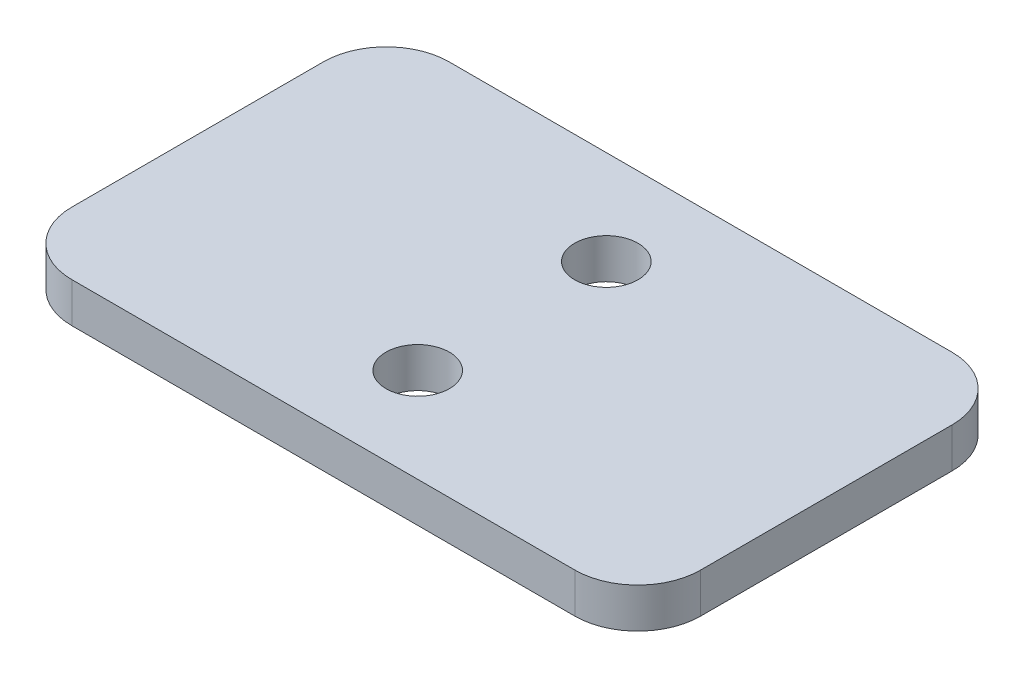
from build123d import *

# Parameters (mm, degrees)
SKETCH1_W               = 100
SKETCH1_H               = 60
BOSS_EXTRUDE1_DEPTH     = 6.35
F_3_8_CLEARANCE_HOLE1_D = 10.0838
FILLET1_R               = 10


with BuildPart() as part:
    # Sketch1 → Boss-Extrude1 (new body)
    with BuildSketch(Plane(origin=(0, 0, 0), x_dir=(1, 0, 0), z_dir=(0, 1, 0))):
        Rectangle(SKETCH1_W, SKETCH1_H)
    extrude(amount=BOSS_EXTRUDE1_DEPTH)

    # 3/8 Clearance Hole1 (through all)
    with Locations(Plane(origin=(0, 6.35, 0), x_dir=(1, 0, 0), z_dir=(0, 1, 0))):
        with Locations((0, 15), (0, -15)):
            Hole(F_3_8_CLEARANCE_HOLE1_D / 2)

    # Fillet1
    fillet1_edges = [part.edges().sort_by_distance(p)[0] for p in [
        (-50, 3.175, 30),
        (-50, 3.175, -30),
        (50, 3.175, -30),
        (50, 3.175, 30),
    ]]
    fillet(fillet1_edges, radius=FILLET1_R)


solid = part.part
